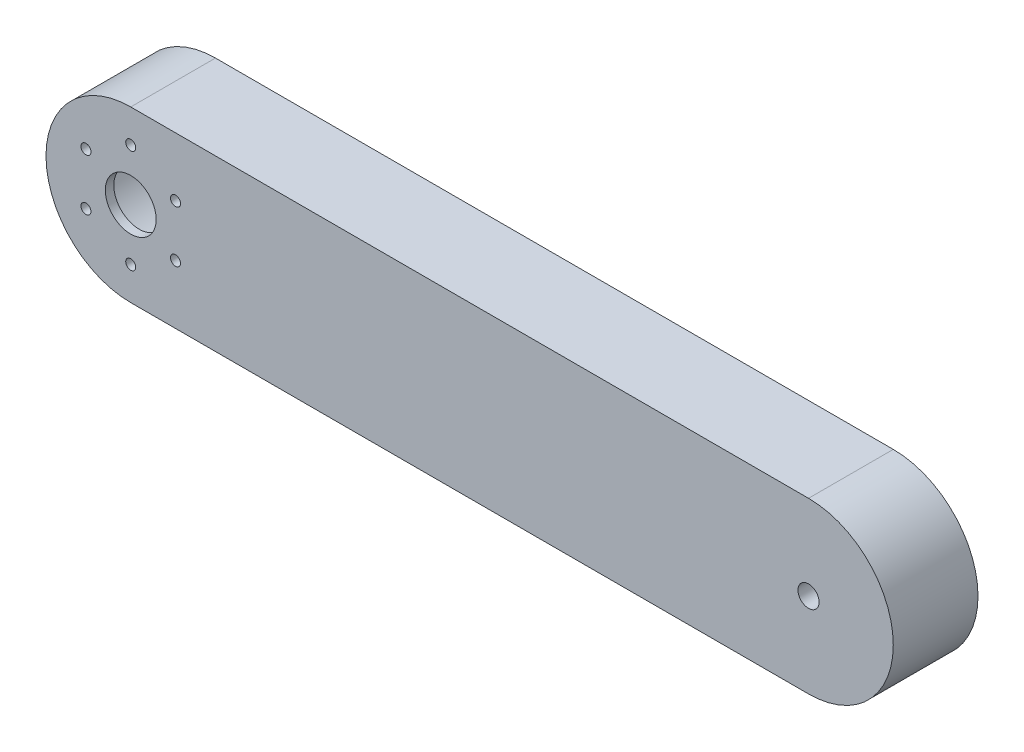
from build123d import *

# Parameters (mm, degrees)
SKETCH1_R           = 25.4
SKETCH1_W           = 203.2
SKETCH1_H           = 50.8
BOSS_EXTRUDE1_DEPTH = 25.4
SKETCH2_R           = 19.05
CUT_EXTRUDE1_DEPTH  = 22.86
SKETCH4_R           = 7.62
SKETCH4_R_2         = 1.500000048
CUT_EXTRUDE2_DEPTH  = 132.517069615
SKETCH3_R           = 3.175
CUT_EXTRUDE3_DEPTH  = 132.982271537


with BuildPart() as part:
    # Sketch1 → Boss-Extrude1 (new body)
    with BuildSketch(Plane.XY):
        with Locations((-101.6, 0)):
            Circle(SKETCH1_R)
        with Locations((101.6, 0)):
            Circle(SKETCH1_R)
        Rectangle(SKETCH1_W, SKETCH1_H)
    extrude(amount=BOSS_EXTRUDE1_DEPTH)

    # Sketch2 → Cut-Extrude1 (cut)
    with BuildSketch(Plane.XY):
        with Locations(Location((-101.6, 0, 0), (0, 0, 180))):
            Circle(SKETCH2_R)
    extrude(amount=CUT_EXTRUDE1_DEPTH, mode=Mode.SUBTRACT)

    # Sketch4 → Cut-Extrude2 (cut, through all)
    with BuildSketch(Plane(origin=(0, 0, 22.86), x_dir=(-1, 0, 0), z_dir=(0, 0, -1))):
        with Locations((101.6, 0)):
            Circle(SKETCH4_R)
        with Locations((101.6, 15.499999988)):
            Circle(SKETCH4_R_2)
        with Locations((115.023393748, 7.749999994)):
            Circle(SKETCH4_R_2)
        with Locations((115.023393748, -7.749999994)):
            Circle(SKETCH4_R_2)
        with Locations((101.6, -15.499999988)):
            Circle(SKETCH4_R_2)
        with Locations((88.176606252, -7.749999994)):
            Circle(SKETCH4_R_2)
        with Locations((88.176606252, 7.749999994)):
            Circle(SKETCH4_R_2)
    extrude(amount=-CUT_EXTRUDE2_DEPTH, mode=Mode.SUBTRACT)

    # Sketch3 → Cut-Extrude3 (cut, through all)
    with BuildSketch(Plane.XY.offset(25.4)):
        with Locations((101.6, 0)):
            Circle(SKETCH3_R)
    extrude(amount=-CUT_EXTRUDE3_DEPTH, mode=Mode.SUBTRACT)


solid = part.part
